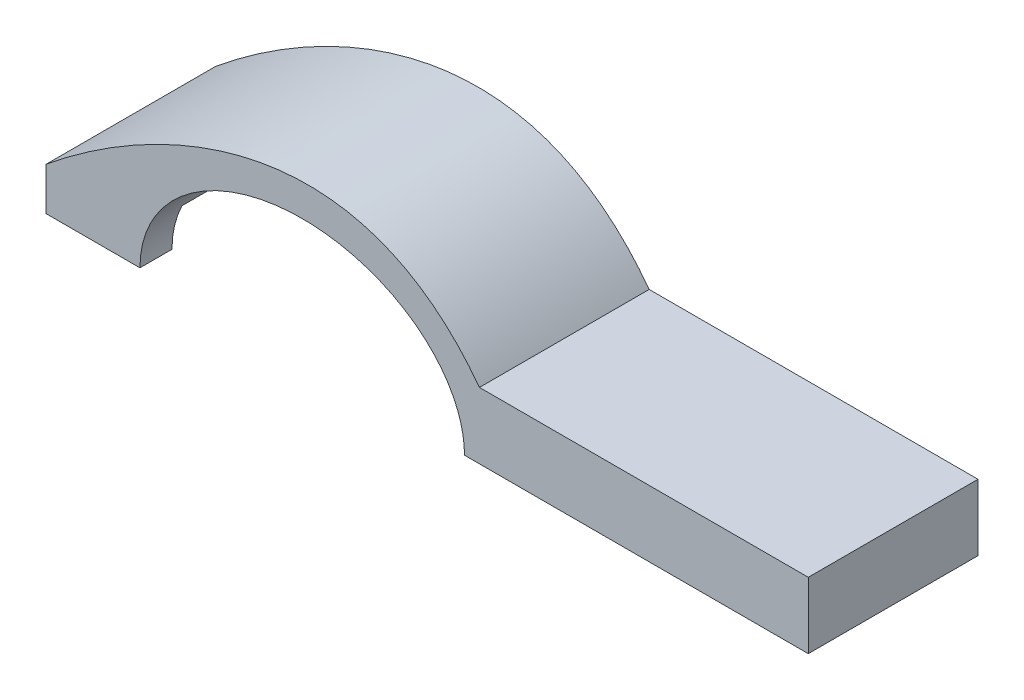
from build123d import *

# Parameters (mm, degrees)
BOSS_EXTRUDE1_DEPTH = 7.95
SKETCH2_W           = 4.95
SKETCH2_H           = 2
CUT_EXTRUDE1_DEPTH  = 7.8
SKETCH3_W           = 13.1
SKETCH3_H           = 4.95
CUT_EXTRUDE2_DEPTH  = 2


with BuildPart() as part:
    # Sketch1 → Boss-Extrude1 (new body)
    with BuildSketch(Plane.XY):
        with BuildLine():
            Line((51.020947764, -4.363511667), (34.920947764, -4.363511667))
            add(Edge.make_bspline(
                [(34.920947764, -4.363511667), (34.920947764, 1.436488333), (27.320947764, 1.436488333), (19.720947764, 1.436488333), (19.720947764, -4.363511667)],
                knots=[0, 0, 0, 1.570796327, 1.570796327, 3.141592654, 3.141592654, 3.141592654], degree=2, weights=[1, 0.707106781, 1, 0.707106781, 1]))
            Line((19.720947764, -4.363511667), (15.320947764, -4.363511667))
            Line((15.320947764, -4.363511667), (15.320947764, -2.363511667))
            add(Edge.make_bspline(
                [(15.320947764, -2.363511667), (20.772849702, 2.124088533), (29.927409835, 6.369725062), (35.620947764, -1.263511667)],
                knots=[0, 0, 0, 0, 1, 1, 1, 1], degree=3))
            Line((35.620947764, -1.263511667), (51.020947764, -1.263511667))
            Line((51.020947764, -1.263511667), (51.020947764, -4.363511667))
        make_face()
    extrude(amount=BOSS_EXTRUDE1_DEPTH)

    # Sketch2 → Cut-Extrude1 (cut)
    with BuildSketch(Plane.ZY.offset(-15.320947764)):
        with Locations((3.975, -3.363511667)):
            Rectangle(SKETCH2_W, SKETCH2_H)
    extrude(amount=-CUT_EXTRUDE1_DEPTH, mode=Mode.SUBTRACT)

    # Sketch3 → Cut-Extrude2 (cut)
    with BuildSketch(Plane.XZ.offset(4.363511667)):
        with Locations((42.970947764, 3.975)):
            Rectangle(SKETCH3_W, SKETCH3_H)
    extrude(amount=-CUT_EXTRUDE2_DEPTH, mode=Mode.SUBTRACT)


solid = part.part
